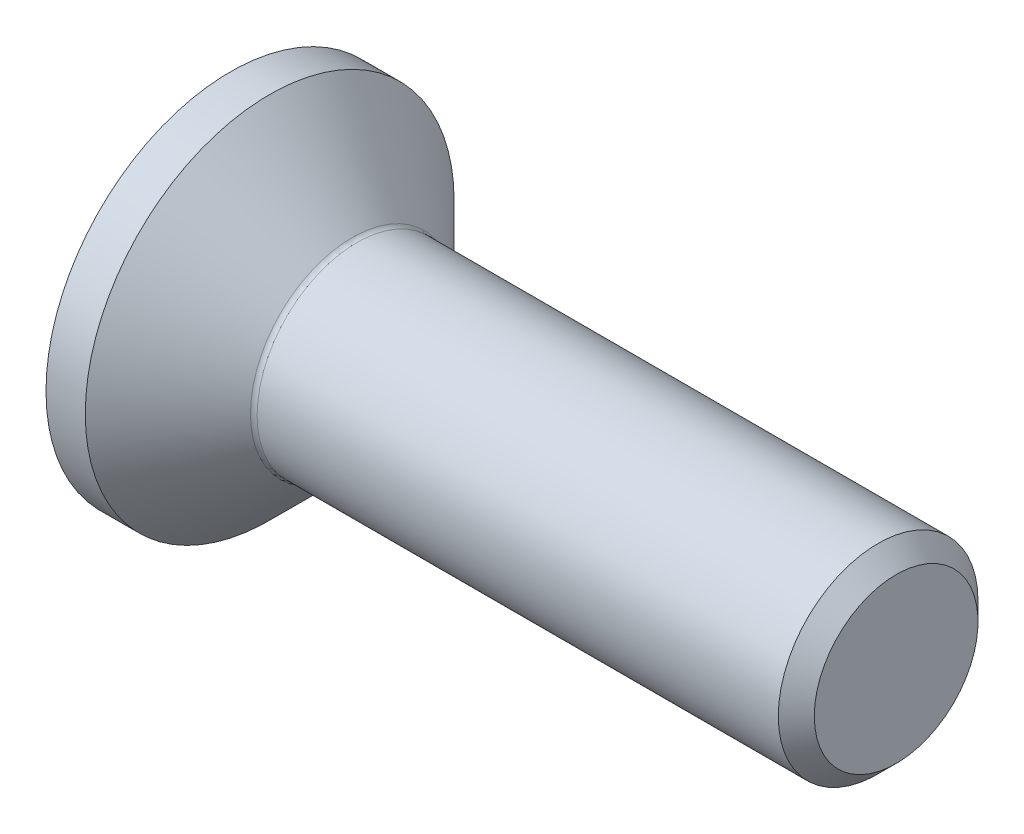
from build123d import *

# Parameters (mm, degrees)
HEXAGONSOCKET_DEPTH = 1.1
HEADFILLET_R        = 0.1
CHAMFER_2_SIZE      = 0.2705
SKETCH4_W           = 5
SKETCH4_H           = 5


with BuildPart() as part:
    # Sketch1 → Base (revolve)
    with BuildSketch(Plane.XY, mode=Mode.PRIVATE) as base_sk:
        Polygon((0, 0), (0, 3.36), (1.86, 1.5), (10, 1.5), (10, 0), align=None)
    revolve(base_sk.sketch.rotate(Axis((-0.587069181, 0, 0), (1, 0, 0)), 90), axis=Axis((-0.587069181, 0, 0), (1, 0, 0)))

    # Sketch2 → HexagonSocket (cut)
    with BuildSketch(Plane(origin=(0, 0, 0), x_dir=(0, 0, -1), z_dir=(1, 0, 0))):
        Polygon((1.154700538, 0), (0.577350269, 1), (-0.577350269, 1), (-1.154700538, 0), (-0.577350269, -1), (0.577350269, -1), align=None)
    extrude(amount=HEXAGONSOCKET_DEPTH, mode=Mode.SUBTRACT)

    # Sketch3 → Cut-Revolve1 (revolve, cut)
    with BuildSketch(Plane.XY, mode=Mode.PRIVATE) as cut_revolve1_sk:
        Polygon((1.1, 1), (1.677350269, 0), (1.1, 0), align=None)
    revolve(cut_revolve1_sk.sketch.rotate(Axis((-0.439109555, 0, 0), (1, 0, 0)), 90), axis=Axis((-0.439109555, 0, 0), (1, 0, 0)), mode=Mode.SUBTRACT)

    # HeadFillet
    headfillet_edges = [part.edges().sort_by_distance(p)[0] for p in [
        (1.86, 0, -1.5),
    ]]
    fillet(headfillet_edges, radius=HEADFILLET_R)

    # Chamfer 2
    chamfer_2_edges = [part.edges().sort_by_distance(p)[0] for p in [
        (10, 0, -1.5),
    ]]
    chamfer(chamfer_2_edges, length=CHAMFER_2_SIZE)

    # Sketch4 → Cut-Revolve2 (revolve, cut)
    with BuildSketch(Plane(origin=(0, 0, 0), x_dir=(1, 0, 0), z_dir=(0, 1, 0)), mode=Mode.PRIVATE) as cut_revolve2_sk:
        with Locations((0.5, 5.27)):
            Rectangle(SKETCH4_W, SKETCH4_H)
    revolve(cut_revolve2_sk.sketch.rotate(Axis((11.853138686, 0, 0), (-1, 0, 0)), 180), axis=Axis((11.853138686, 0, 0), (-1, 0, 0)), mode=Mode.SUBTRACT)


solid = part.part
